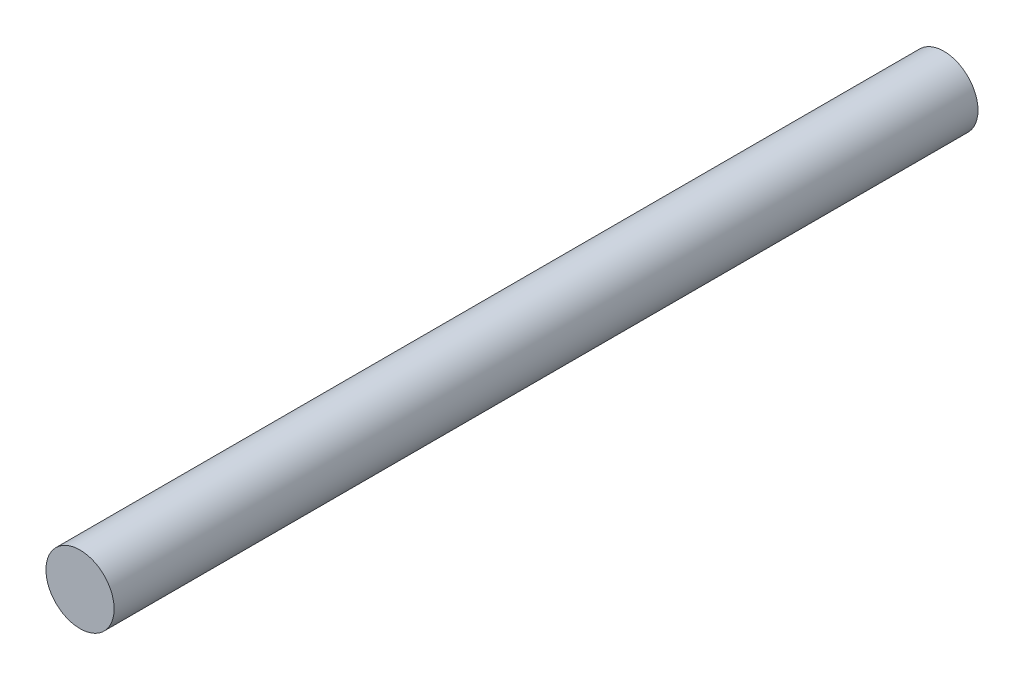
from build123d import *

# Parameters (mm, degrees)
SKETCH1_R           = 0.75
BOSS_EXTRUDE1_DEPTH = 19


with BuildPart() as part:
    # Sketch1 → Boss-Extrude1 (new body)
    with BuildSketch(Plane.XY):
        Circle(SKETCH1_R)
    extrude(amount=BOSS_EXTRUDE1_DEPTH)


solid = part.part
